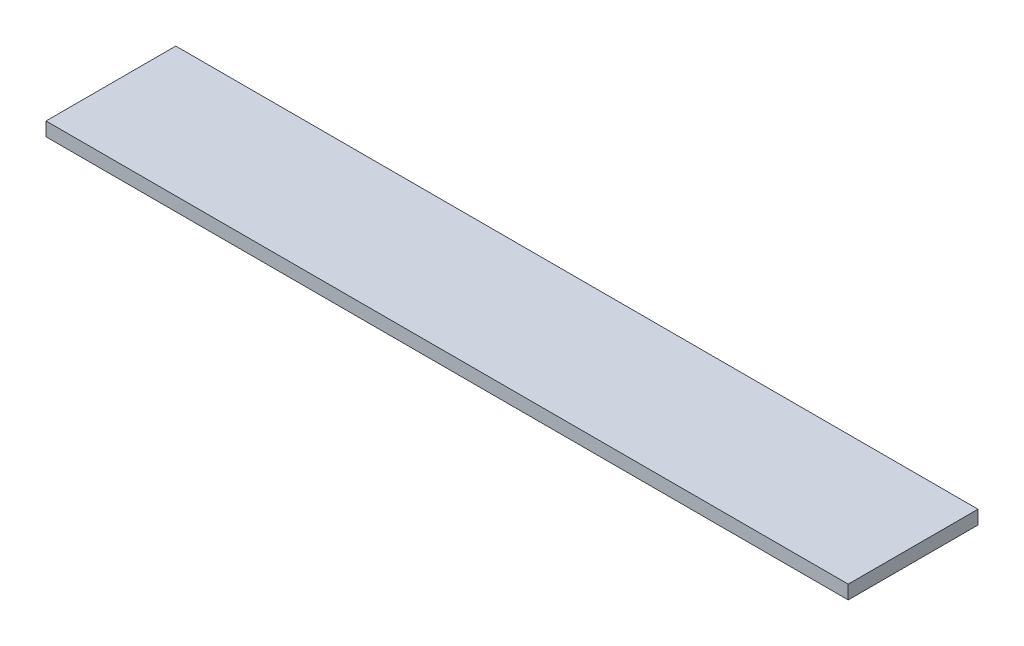
from build123d import *

# Parameters (mm, degrees)
SKETCH_1_W      = 272
SKETCH_1_H      = 44
EXTRUDE_1_DEPTH = 4.65


with BuildPart() as part:
    # 草图1 → 凸台-拉伸1 (new body)
    with BuildSketch(Plane(origin=(0, 0, 0), x_dir=(1, 0, 0), z_dir=(0, 1, 0))):
        with Locations((136, 22)):
            Rectangle(SKETCH_1_W, SKETCH_1_H)
    extrude(amount=EXTRUDE_1_DEPTH)


solid = part.part
